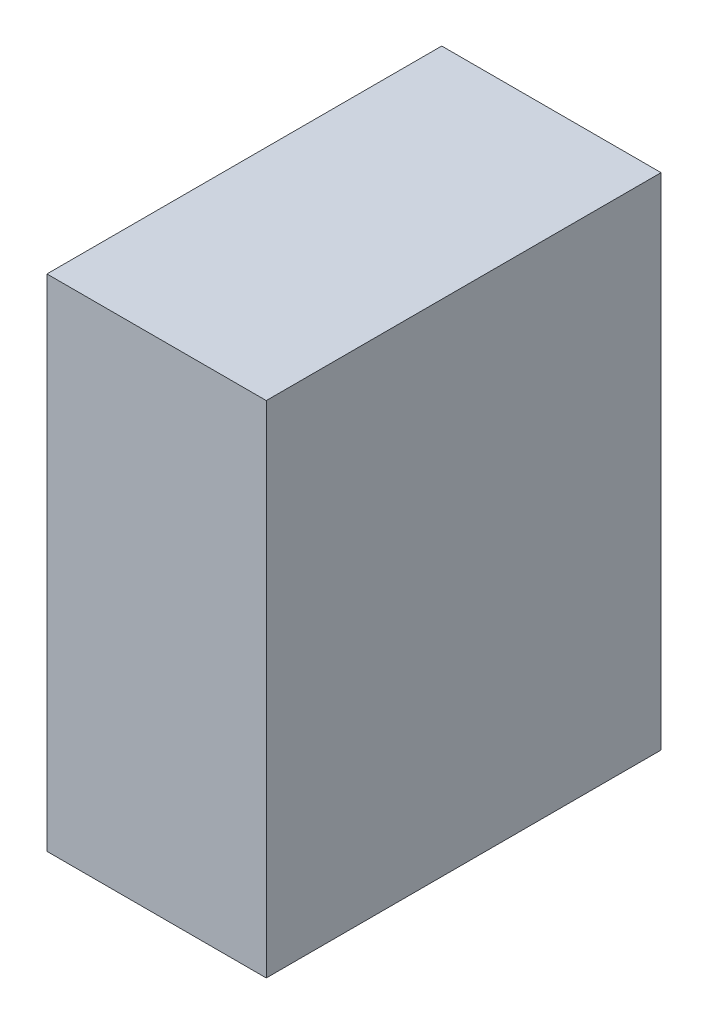
from build123d import *

# Parameters (mm, degrees)
ESBO_O1_W                = 50
ESBO_O1_H                = 114
RESSALTO_EXTRUS_O1_DEPTH = 90


with BuildPart() as part:
    # Esboço1 → Ressalto-extrusão1 (new body)
    with BuildSketch(Plane.XY):
        with Locations((25, 57)):
            Rectangle(ESBO_O1_W, ESBO_O1_H)
    extrude(amount=RESSALTO_EXTRUS_O1_DEPTH)


solid = part.part
